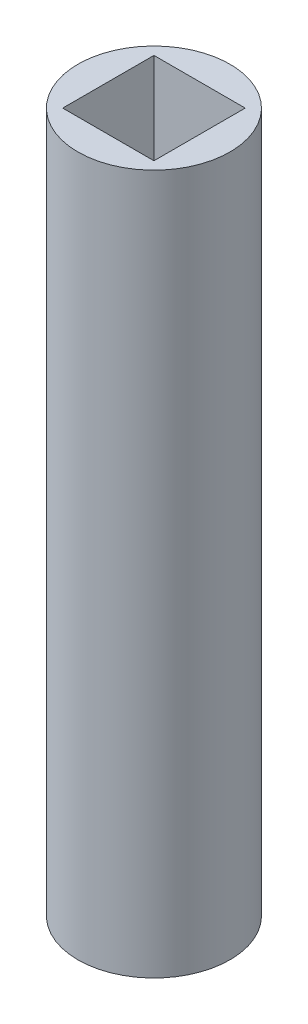
from build123d import *

# Parameters (mm, degrees)
SKETCH1_R           = 15.875
BOSS_EXTRUDE1_DEPTH = 146.05
SKETCH2_W           = 19.05
SKETCH2_H           = 19.05
CUT_EXTRUDE1_DEPTH  = 172.72


with BuildPart() as part:
    # Sketch1 → Boss-Extrude1 (new body)
    with BuildSketch(Plane(origin=(0, 0, 0), x_dir=(1, 0, 0), z_dir=(0, 1, 0))):
        with Locations(Location((0, 0, 0), (0, 0, 270))):
            Circle(SKETCH1_R)
    extrude(amount=BOSS_EXTRUDE1_DEPTH)

    # Sketch2 → Cut-Extrude1 (cut)
    with BuildSketch(Plane(origin=(0, 146.05, 0), x_dir=(1, 0, 0), z_dir=(0, 1, 0))):
        Rectangle(SKETCH2_W, SKETCH2_H)
    extrude(amount=-CUT_EXTRUDE1_DEPTH, mode=Mode.SUBTRACT)


solid = part.part
